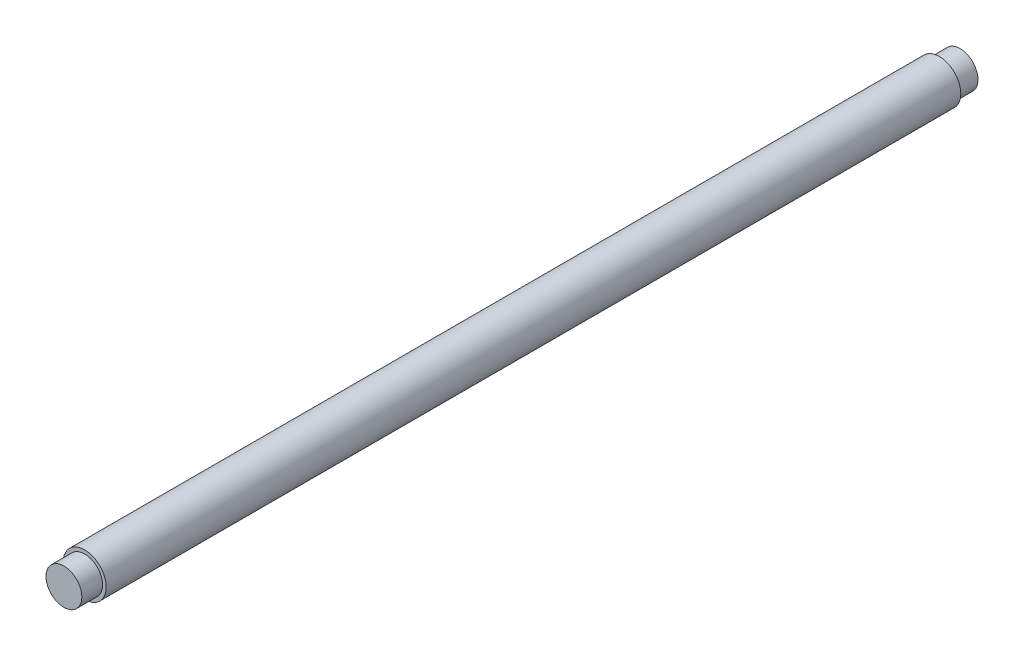
from build123d import *

# Parameters (mm, degrees)
SKETCH_1_R          = 6
EXTRUDE_1_DEPTH     = 250
CUT_EXTRUDE_START   = -5.8
SKETCH_2_R          = 6
SKETCH_2_R_2        = 5
CUT_EXTRUDE_1_DEPTH = 5.8


with BuildPart() as part:
    # ｽｹｯﾁ1 → ﾎﾞｽ - 押し出し1 (new body)
    with BuildSketch(Plane.XY):
        Circle(SKETCH_1_R)
    extrude(amount=EXTRUDE_1_DEPTH)

    # ｽｹｯﾁ2 → ｶｯﾄ - 押し出し1 (cut)
    with BuildSketch(Plane.XY.offset(250).offset(CUT_EXTRUDE_START)):
        Circle(SKETCH_2_R)
        Circle(SKETCH_2_R_2, mode=Mode.SUBTRACT)
    cut_extrude_1 = extrude(amount=CUT_EXTRUDE_1_DEPTH, mode=Mode.SUBTRACT)

    # ﾐﾗｰ1: ｶｯﾄ - 押し出し1 across plane
    add(cut_extrude_1.mirror(Plane.XY.offset(125)), mode=Mode.SUBTRACT)


solid = part.part
